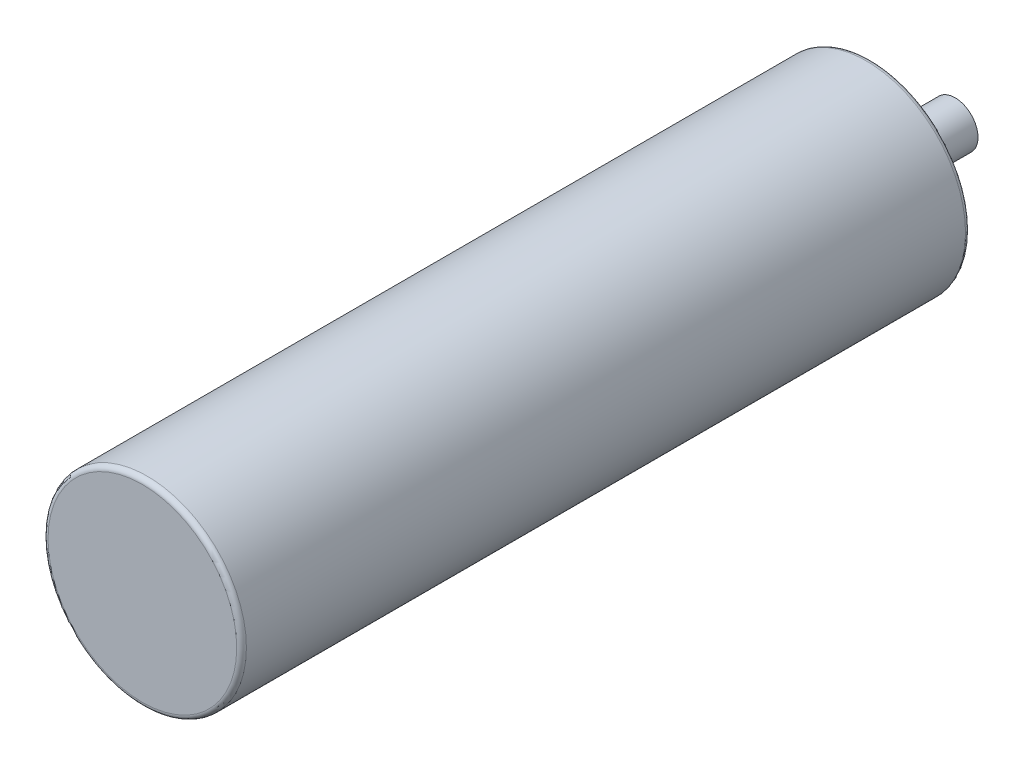
from build123d import *

# Parameters (mm, degrees)
SKETCH1_R                 = 26
BODY_DEPTH                = 191
SKETCH2_R                 = 6
AXLE_DEPTH                = 22
FLAT_START                = -15
SKETCH3_R                 = 1.016
FLAT_DEPTH                = 15
M5X0_8_TAPPED_HOLE1_D     = 4.2
M5X0_8_TAPPED_HOLE1_DEPTH = 32.0000122
M5X0_8_TAPPED_HOLE1_TIP   = 1.2618073
FILLET1_R                 = 1.27


with BuildPart() as part:
    # Sketch1 → body (new body)
    with BuildSketch(Plane.XY):
        Circle(SKETCH1_R)
    extrude(amount=BODY_DEPTH)

    # Sketch2 → axle (add)
    with BuildSketch(Plane(origin=(0, 0, 0), x_dir=(-1, 0, 0), z_dir=(0, 0, -1))):
        with Locations(Location((0, 0, 0), (0, 0, 180))):
            Circle(SKETCH2_R)
    extrude(amount=AXLE_DEPTH)

    # Sketch3 → flat (cut)
    with BuildSketch(Plane(origin=(0, 0, -22), x_dir=(-1, 0, 0), z_dir=(0, 0, -1)).offset(FLAT_START)):
        with BuildLine():
            Line((4.472135955, -4), (-4.472135955, -4))
            ThreePointArc((-4.472135955, -4), (0, -6), (4.472135955, -4))
        make_face()
        Circle(SKETCH3_R)
    extrude(amount=FLAT_DEPTH, mode=Mode.SUBTRACT)

    # M5x0.8 Tapped Hole1
    with Locations(Plane(origin=(0, 0, 0), x_dir=(-1, 0, 0), z_dir=(0, 0, -1))):
        with Locations((0, -20), (-20, 0), (0, 20), (20, 0)):
            Hole(M5X0_8_TAPPED_HOLE1_D / 2, depth=M5X0_8_TAPPED_HOLE1_DEPTH)
            with Locations((0, 0, -(M5X0_8_TAPPED_HOLE1_DEPTH + M5X0_8_TAPPED_HOLE1_TIP / 2))):  # 118° drill point
                Cone(0, M5X0_8_TAPPED_HOLE1_D / 2, M5X0_8_TAPPED_HOLE1_TIP, mode=Mode.SUBTRACT)

    # Fillet1
    fillet1_edges = [part.edges().sort_by_distance(p)[0] for p in [
        (-26, 0, 0),
        (-26, 0, 191),
    ]]
    fillet(fillet1_edges, radius=FILLET1_R)


solid = part.part
